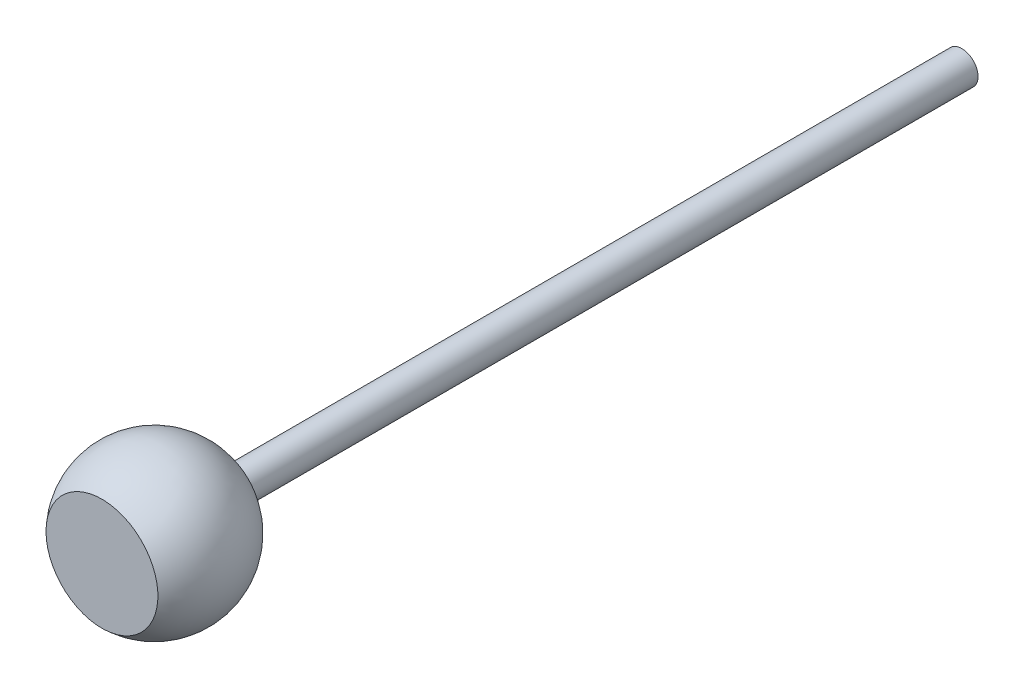
from build123d import *

# Parameters (mm, degrees)
SKETCH1_R               = 2
BOSS_EXTRUDE1_DEPTH     = 40
BOSS_EXTRUDE2_START     = 60
SKETCH5_R               = 2
BOSS_EXTRUDE2_DEPTH     = 60
CUT_EXTRUDE1_DEPTH      = 62.485770712
CUT_EXTRUDE1_DEPTH_BACK = 62.485770712


with BuildPart() as part:
    # Sketch1 → Boss-Extrude1 (new body)
    with BuildSketch(Plane.XY):
        Circle(SKETCH1_R)
    extrude(amount=BOSS_EXTRUDE1_DEPTH)

    # Sketch2 → Revolve1 (revolve)
    with BuildSketch(Plane(origin=(0, 0, 0), x_dir=(1, 0, 0), z_dir=(0, 1, 0))):
        with BuildLine():
            Line((-9.5, -40), (9.5, -40))
            ThreePointArc((9.5, -40), (0, -30.5), (-9.5, -40))
        make_face()
    revolve(axis=Axis((-9.5, 0, 40), (1, 0, 0)))

    # Sketch5 → Boss-Extrude2 (add)
    with BuildSketch(Plane(origin=(0, 0, 0), x_dir=(-1, 0, 0), z_dir=(0, 0, -1)).offset(BOSS_EXTRUDE2_START)):
        Circle(SKETCH5_R)
    extrude(amount=-BOSS_EXTRUDE2_DEPTH)

    # Sketch6 → Cut-Extrude1 (cut, two sides: drawn at the far end of the back side and taken through both)
    with BuildSketch(Plane(origin=(0, 0, 0), x_dir=(0, 0, -1), z_dir=(1, 0, 0)).offset(-CUT_EXTRUDE1_DEPTH_BACK)):
        Polygon((-46.5, 0), (-46.5, 12.012765668), (-54.329815316, 12.012765668), (-54.329815316, -12.092015027), (-46.5, -12.092015027), align=None)
    extrude(amount=CUT_EXTRUDE1_DEPTH + CUT_EXTRUDE1_DEPTH_BACK, mode=Mode.SUBTRACT)


solid = part.part
